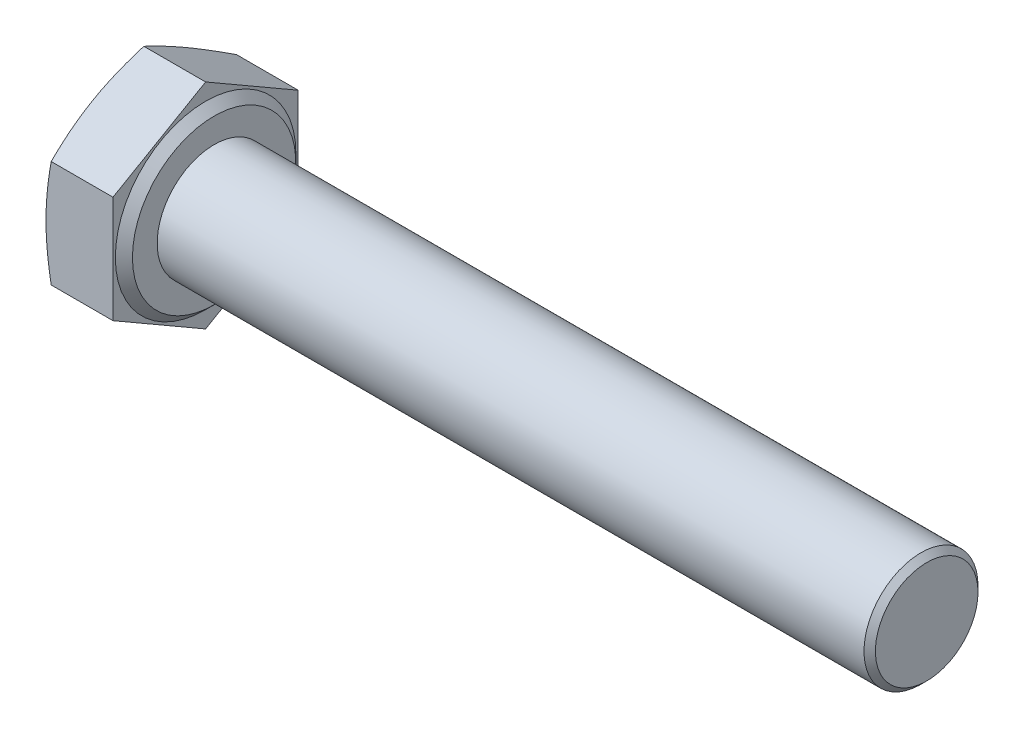
from build123d import *

# Parameters (mm, degrees)
BASEHEAD_DEPTH = 5.3
SKETCH5_R      = 4
BASEBODY_DEPTH = 50
CHAMFER1_SIZE  = 0.4


with BuildPart() as part:
    # Sketch2 → BaseHead (new body)
    with BuildSketch(Plane(origin=(0, 0, 0), x_dir=(0, 0, -1), z_dir=(1, 0, 0))):
        Polygon((0, -7.505553499), (6.5, -3.75277675), (6.5, 3.75277675), (0, 7.505553499), (-6.5, 3.75277675), (-6.5, -3.75277675), align=None)
    extrude(amount=BASEHEAD_DEPTH)

    # Sketch3 → BearingFace (revolve, cut)
    with BuildSketch(Plane.XY, mode=Mode.PRIVATE) as bearingface_sk:
        Polygon((5.3, 7.505553499), (5.3, 5.735), (4.7, 6.335), (4.7, 7.505553499), align=None)
    revolve(bearingface_sk.sketch.rotate(Axis((-0.957090588, 0, 0), (1, 0, 0)), 90), axis=Axis((-0.957090588, 0, 0), (1, 0, 0)), mode=Mode.SUBTRACT)

    # Sketch4 → HeadChamfer (revolve, cut)
    with BuildSketch(Plane.XY):
        Polygon((0, 7.505553499), (0.365991543, 7.505553499), (0, 6.5), align=None)
    revolve(axis=Axis((-0.493528746, 0, 0), (1, 0, 0)), mode=Mode.SUBTRACT)

    # Sketch5 → BaseBody (add)
    with BuildSketch(Plane(origin=(5.3, 0, 0), x_dir=(0, 0, -1), z_dir=(1, 0, 0))):
        Circle(SKETCH5_R)
    extrude(amount=BASEBODY_DEPTH)

    # Chamfer1
    chamfer1_edges = [part.edges().sort_by_distance(p)[0] for p in [
        (55.3, 0, 4),
    ]]
    chamfer(chamfer1_edges, length=CHAMFER1_SIZE)


solid = part.part
